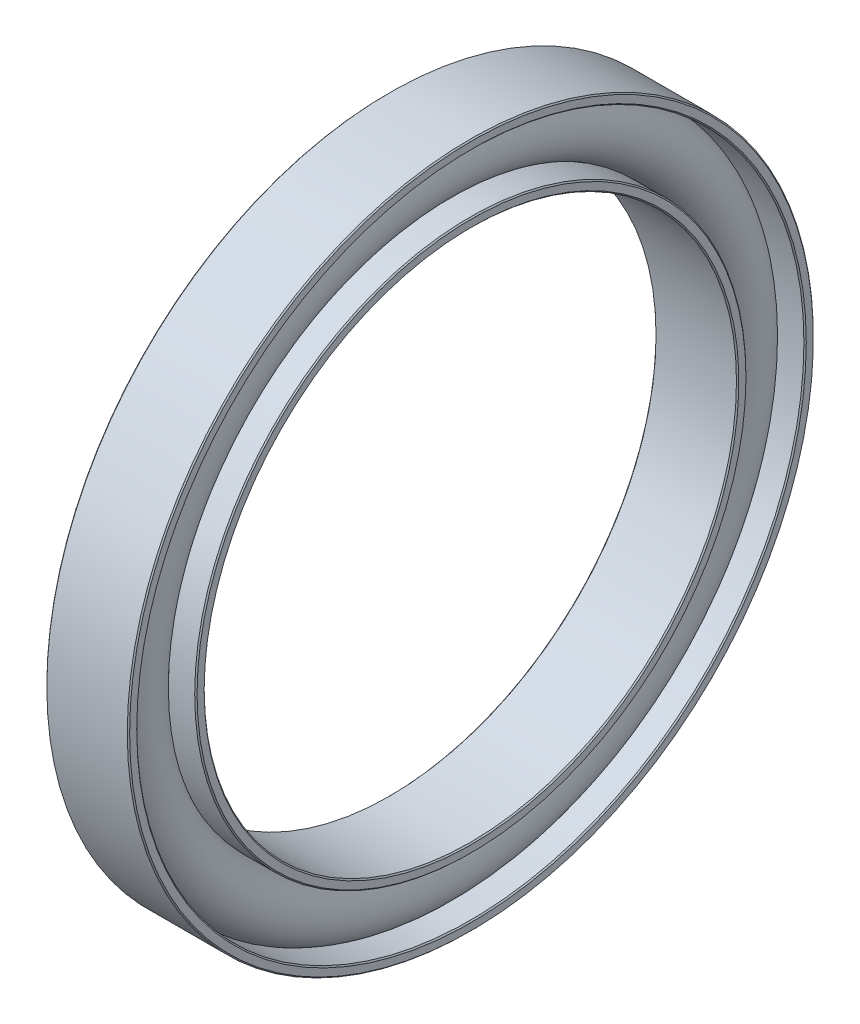
from build123d import *


with BuildPart() as part:
    # Esquisse1 → Révolution1 (revolve)
    with BuildSketch(Plane.XY, mode=Mode.PRIVATE) as r_volution1_sk:
        with BuildLine():
            Line((-3.5, 28.9), (-3.4, 29))
            Line((-3.4, 29), (3.4, 29))
            Line((3.4, 29), (3.5, 28.9))
            Line((3.5, 28.9), (3.5, 28.3))
            Line((3.5, 28.3), (3.4, 28.2))
            Line((3.4, 28.2), (0.75, 28.2))
            ThreePointArc((0.75, 28.2), (2.562225595, 25.75), (0.75, 23.3))
            Line((0.75, 23.3), (3.4, 23.3))
            Line((3.4, 23.3), (3.5, 23.2))
            Line((3.5, 23.2), (3.5, 22.6))
            Line((3.5, 22.6), (3.4, 22.5))
            Line((3.4, 22.5), (-3.4, 22.5))
            Line((-3.4, 22.5), (-3.5, 22.6))
            Line((-3.5, 22.6), (-3.5, 23.2))
            Line((-3.5, 23.2), (-3.4, 23.3))
            Line((-3.4, 23.3), (-0.75, 23.3))
            ThreePointArc((-0.75, 23.3), (-2.562225595, 25.75), (-0.75, 28.2))
            Line((-0.75, 28.2), (-3.4, 28.2))
            Line((-3.4, 28.2), (-3.5, 28.3))
            Line((-3.5, 28.3), (-3.5, 28.9))
        make_face()
    revolve(r_volution1_sk.sketch.rotate(Axis((-2.661437812, 0, 0), (1, 0, 0)), 90), axis=Axis((-2.661437812, 0, 0), (1, 0, 0)))


solid = part.part
